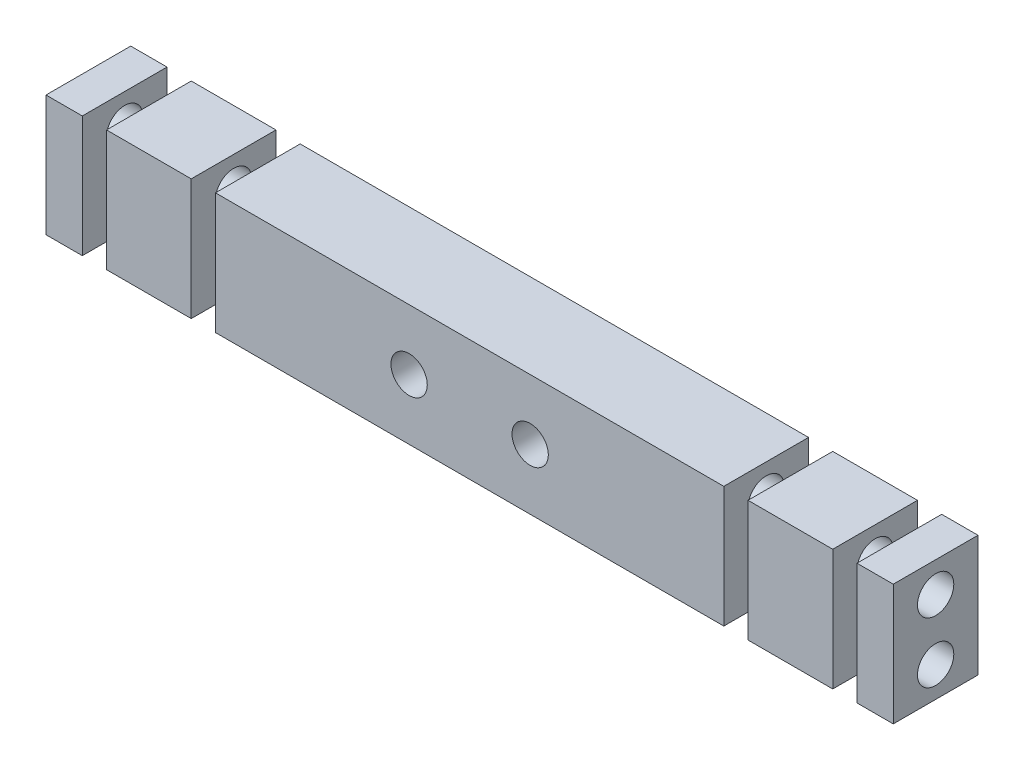
from build123d import *

# Parameters (mm, degrees)
SKETCH_1_W          = 70
SKETCH_1_H          = 7
EXTRUDE_1_DEPTH     = 10
SKETCH_2_W          = 2
SKETCH_2_H          = 10
CUT_EXTRUDE_1_DEPTH = 7
SKETCH_4_R          = 1.5
CUT_EXTRUDE_2_DEPTH = 20
SKETCH_5_R          = 1.5
CUT_EXTRUDE_3_DEPTH = 20
SKETCH_6_R          = 1.5
CUT_EXTRUDE_4_DEPTH = 7


with BuildPart() as part:
    # Эскиз1 → Бобышка-Вытянуть1 (new body)
    with BuildSketch(Plane(origin=(0, 0, 0), x_dir=(1, 0, 0), z_dir=(0, 1, 0))):
        with Locations((-17.432449075, 2.048422225)):
            Rectangle(SKETCH_1_W, SKETCH_1_H)
    extrude(amount=EXTRUDE_1_DEPTH)

    # Эскиз2 → Вырез-Вытянуть1 (cut)
    with BuildSketch(Plane(origin=(0, 0, -5.548422225), x_dir=(-1, 0, 0), z_dir=(0, 0, -1))):
        with Locations((-13.567550925, 5)):
            Rectangle(SKETCH_2_W, SKETCH_2_H)
        with Locations((48.432449075, 5)):
            Rectangle(SKETCH_2_W, SKETCH_2_H)
        with Locations((39.432449075, 5)):
            Rectangle(SKETCH_2_W, SKETCH_2_H)
        with Locations((-4.567550925, 5)):
            Rectangle(SKETCH_2_W, SKETCH_2_H)
    extrude(amount=-CUT_EXTRUDE_1_DEPTH, mode=Mode.SUBTRACT)


with BuildPart() as cut_extrude_1_piece_1:
    # of the separate pieces the step leaves, piece 1, a body of its own (cut_extrude_1_pieces)
    add(part.part.solids().sort_by_distance((-38.432449075, 0, -5.548422225))[0])


with BuildPart() as cut_extrude_1_piece_2:
    # of the separate pieces the step leaves, piece 2, a body of its own (cut_extrude_1_pieces)
    add(part.part.solids().sort_by_distance((5.567550925, 0, -5.548422225))[0])


with BuildPart() as cut_extrude_1_piece_3:
    # of the separate pieces the step leaves, piece 3, a body of its own (cut_extrude_1_pieces)
    add(part.part.solids().sort_by_distance((-47.432449075, 0, -5.548422225))[0])


with BuildPart() as cut_extrude_1_piece_4:
    # of the separate pieces the step leaves, piece 4, a body of its own (cut_extrude_1_pieces)
    add(part.part.solids().sort_by_distance((-52.432449075, 0, -5.548422225))[0])


with BuildPart() as cut_extrude_1_piece_5:
    # of the separate pieces the step leaves, piece 5, a body of its own (cut_extrude_1_pieces)
    add(part.part.solids().sort_by_distance((14.567550925, 0, -5.548422225))[0])


with BuildPart() as cut_extrude_2_tool:
    # Эскиз4 → Вырез-Вытянуть2 (new body)
    with BuildSketch(Plane(origin=(17.567550925, 0, 0), x_dir=(0, 0, -1), z_dir=(1, 0, 0))):
        with Locations(Location((2.048422225, 7.5, 0), (0, 0, 90))):
            Circle(SKETCH_4_R)
        with Locations(Location((2.048422225, 2.5, 0), (0, 0, 90))):
            Circle(SKETCH_4_R)
    extrude(amount=-CUT_EXTRUDE_2_DEPTH)


with BuildPart() as cut_extrude_1_piece_1_1:
    add(cut_extrude_1_piece_1.part)

    # Вырез-Вытянуть2: cut by cut_extrude_2_tool
    add(cut_extrude_2_tool.part, mode=Mode.SUBTRACT)


with BuildPart() as cut_extrude_1_piece_2_1:
    add(cut_extrude_1_piece_2.part)

    # Вырез-Вытянуть2: cut by cut_extrude_2_tool
    add(cut_extrude_2_tool.part, mode=Mode.SUBTRACT)


with BuildPart() as cut_extrude_1_piece_5_1:
    add(cut_extrude_1_piece_5.part)

    # Вырез-Вытянуть2: cut by cut_extrude_2_tool
    add(cut_extrude_2_tool.part, mode=Mode.SUBTRACT)


with BuildPart() as cut_extrude_3_tool:
    # Эскиз5 → Вырез-Вытянуть3 (new body)
    with BuildSketch(Plane.ZY.offset(52.432449075)):
        with Locations(Location((-2.048422225, 7.5, 0), (0, 0, 90))):
            Circle(SKETCH_5_R)
        with Locations(Location((-2.048422225, 2.5, 0), (0, 0, 90))):
            Circle(SKETCH_5_R)
    extrude(amount=-CUT_EXTRUDE_3_DEPTH)


with BuildPart() as cut_extrude_1_piece_1_2:
    add(cut_extrude_1_piece_1_1.part)

    # Вырез-Вытянуть3: cut by cut_extrude_3_tool
    add(cut_extrude_3_tool.part, mode=Mode.SUBTRACT)

    # Эскиз6 → Вырез-Вытянуть4 (cut)
    with BuildSketch(Plane.XY.offset(1.451577775)):
        with Locations((-22.432449075, 5)):
            Circle(SKETCH_6_R)
        with Locations((-12.432449075, 5)):
            Circle(SKETCH_6_R)
    extrude(amount=-CUT_EXTRUDE_4_DEPTH, mode=Mode.SUBTRACT)


with BuildPart() as cut_extrude_1_piece_3_1:
    add(cut_extrude_1_piece_3.part)

    # Вырез-Вытянуть3: cut by cut_extrude_3_tool
    add(cut_extrude_3_tool.part, mode=Mode.SUBTRACT)


with BuildPart() as cut_extrude_1_piece_4_1:
    add(cut_extrude_1_piece_4.part)

    # Вырез-Вытянуть3: cut by cut_extrude_3_tool
    add(cut_extrude_3_tool.part, mode=Mode.SUBTRACT)


solid = Compound([cut_extrude_1_piece_2_1.part, cut_extrude_1_piece_5_1.part, cut_extrude_1_piece_1_2.part, cut_extrude_1_piece_3_1.part, cut_extrude_1_piece_4_1.part])
